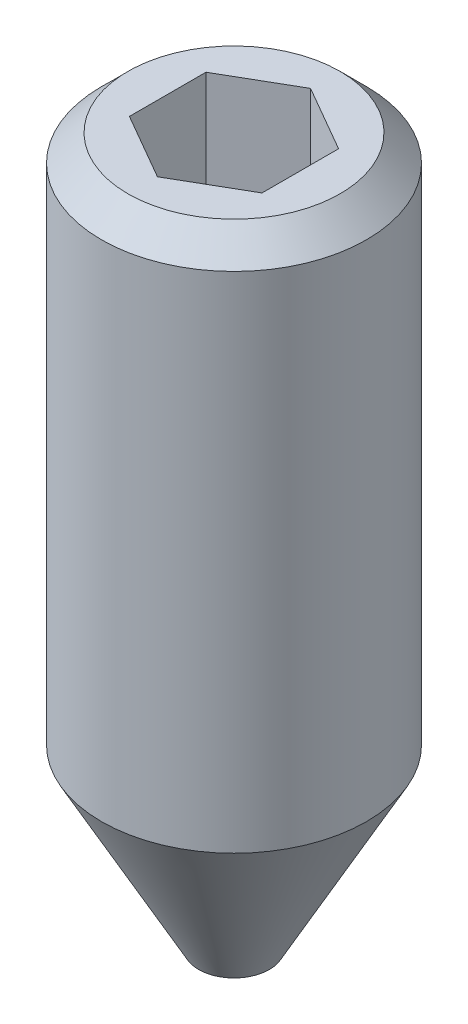
from build123d import *

# Parameters (mm, degrees)
CUT_EXTRUDE1_DEPTH = 2


with BuildPart() as part:
    # Sketch1 → Base-Revolve (revolve)
    with BuildSketch(Plane.XY, mode=Mode.PRIVATE) as base_revolve_sk:
        Polygon((0, -8), (0.4, -8), (1.5, -6), (1.5, -0.3), (1.2, 0), (0, 0), align=None)
    revolve(base_revolve_sk.sketch.rotate(Axis((0, -34, 0), (0, 1, 0)), 90), axis=Axis((0, -34, 0), (0, 1, 0)))

    # Sketch2 → Cut-Extrude1 (cut)
    with BuildSketch(Plane(origin=(0, 0, 0), x_dir=(1, 0, 0), z_dir=(0, 1, 0))):
        Polygon((0.75, 0.433012702), (0, 0.866025404), (-0.75, 0.433012702), (-0.75, -0.433012702), (0, -0.866025404), (0.75, -0.433012702), align=None)
    extrude(amount=-CUT_EXTRUDE1_DEPTH, mode=Mode.SUBTRACT)


solid = part.part
